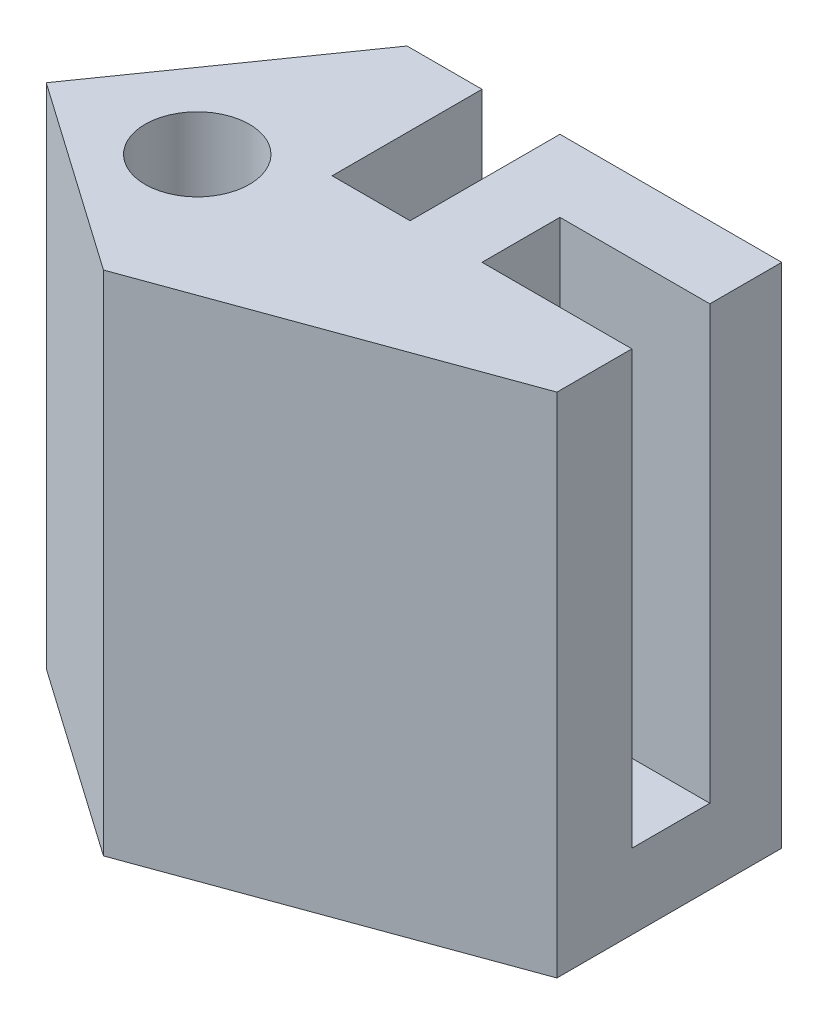
from build123d import *

# Parameters (mm, degrees)
BOSS_EXTRUDE1_DEPTH      = 36.650000106
BOSS_EXTRUDE3_DEPTH      = 6.35
S_0_348_DIAMETER_HOLE1_D = 8.8392


with BuildPart() as part:
    # Sketch1 → Boss-Extrude1 (new body)
    with BuildSketch(Plane(origin=(0, 0, 0), x_dir=(1, 0, 0), z_dir=(0, 1, 0))):
        Polygon((12.954, 19.05), (31.75, 19.05), (31.75, 12.954), (19.05, 12.954), (19.05, 6.35), (31.75, 6.35), (31.75, 0), (3.574718809, -10.254963696), (-12.592782584, 1.065642654), (0, 19.05), (6.35, 19.05), (6.35, 6.35), (12.954, 6.35), align=None)
    extrude(amount=BOSS_EXTRUDE1_DEPTH)

    # Sketch8 → Boss-Extrude3 (add)
    with BuildSketch(Plane.XZ):
        Polygon((6.35, -19.05), (12.954, -19.05), (31.75, -19.05), (31.75, -12.954), (31.75, -6.35), (31.75, 0), (3.574718809, 10.254963696), (-12.592782584, -1.065642654), (0, -19.05), align=None)
    extrude(amount=BOSS_EXTRUDE3_DEPTH)

    # S (0.348) Diameter Hole1 (through all)
    with Locations(Plane(origin=(0, 36.650000106, 0), x_dir=(1, 0, 0), z_dir=(0, 1, 0))):
        with Locations((-0.939868465, 2.208486712)):
            Hole(S_0_348_DIAMETER_HOLE1_D / 2)


solid = part.part
